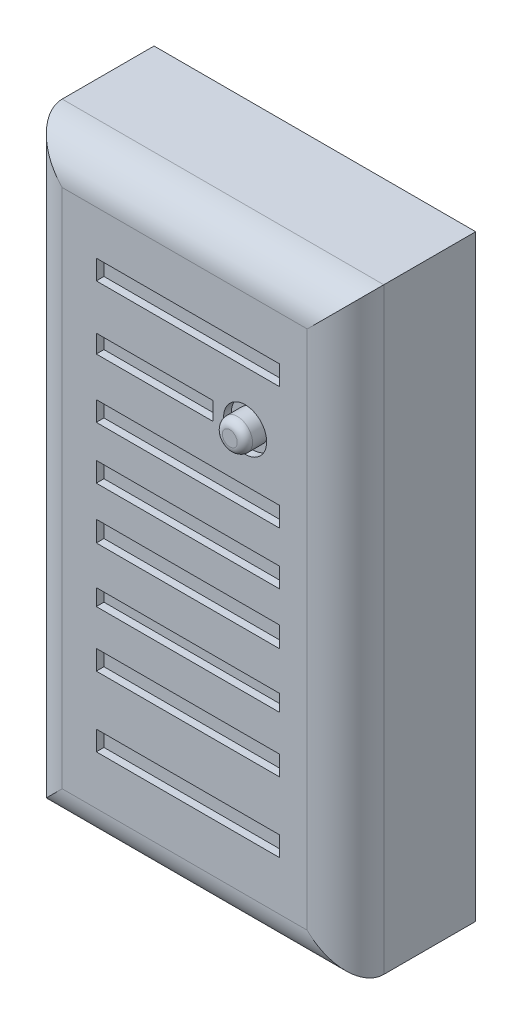
from build123d import *

# Parameters (mm, degrees)
SKETCH_1_W          = 42
SKETCH_1_H          = 78
EXTRUDE_1_DEPTH     = 17
FILLET_1_R          = 5
SKETCH_2_R          = 2.810395333
SKETCH_2_W          = 23.945669991
SKETCH_2_H          = 2.577112466
SKETCH_2_W_2        = 15.24791542
SKETCH_2_H_2        = 2.362353093
SKETCH_2_H_3        = 2.577112465
SKETCH_2_H_4        = 2.684492151
SKETCH_2_H_5        = 2.147593721
CUT_EXTRUDE_1_DEPTH = 1
SKETCH_3_R          = 1.971229003
EXTRUDE_2_DEPTH     = 3
FILLET_2_R          = 1


with BuildPart() as part:
    # Эскиз1 → Бобышка-Вытянуть1 (new body)
    with BuildSketch(Plane.XY):
        with Locations((4.449416517, -23.815978456)):
            Rectangle(SKETCH_1_W, SKETCH_1_H)
    extrude(amount=EXTRUDE_1_DEPTH)

    # Скругление1
    fillet_1_edges = [part.edges().sort_by_distance(p)[0] for p in [
        (25.449416517, -23.815978456, 17),
        (4.449416517, 15.184021544, 17),
        (-16.550583483, -23.815978456, 17),
        (4.449416517, -62.815978456, 17),
    ]]
    fillet(fillet_1_edges, radius=FILLET_1_R)

    # Эскиз2 → Вырез-Вытянуть1 (cut)
    with BuildSketch(Plane.XY.offset(17)):
        with Locations((12.341823442, -5.239292768)):
            Circle(SKETCH_2_R)
        with Locations((4.878935262, 3.136322744)):
            Rectangle(SKETCH_2_W, SKETCH_2_H)
        with Locations((0.530057976, -5.239292769)):
            Rectangle(SKETCH_2_W_2, SKETCH_2_H_2)
        with Locations((4.878935262, -12.863250478)):
            Rectangle(SKETCH_2_W, SKETCH_2_H_3)
        with Locations((4.878935262, -19.735550386)):
            Rectangle(SKETCH_2_W, SKETCH_2_H)
        with Locations((4.878935262, -26.446780765)):
            Rectangle(SKETCH_2_W, SKETCH_2_H_4)
        with Locations((4.878935262, -33.909668946)):
            Rectangle(SKETCH_2_W, SKETCH_2_H_5)
        with Locations((4.878935262, -40.996728225)):
            Rectangle(SKETCH_2_W, SKETCH_2_H)
        with Locations((4.878935262, -50.12400154)):
            Rectangle(SKETCH_2_W, SKETCH_2_H_3)
    extrude(amount=-CUT_EXTRUDE_1_DEPTH, mode=Mode.SUBTRACT)

    # Эскиз3 → Бобышка-Вытянуть2 (add)
    with BuildSketch(Plane.XY.offset(16)):
        with Locations((12.341823442, -5.239292768)):
            Circle(SKETCH_3_R)
    extrude(amount=EXTRUDE_2_DEPTH)

    # Скругление2
    fillet_2_edges = [part.edges().sort_by_distance(p)[0] for p in [
        (10.370594439, -5.239292768, 19),
    ]]
    fillet(fillet_2_edges, radius=FILLET_2_R)


solid = part.part
